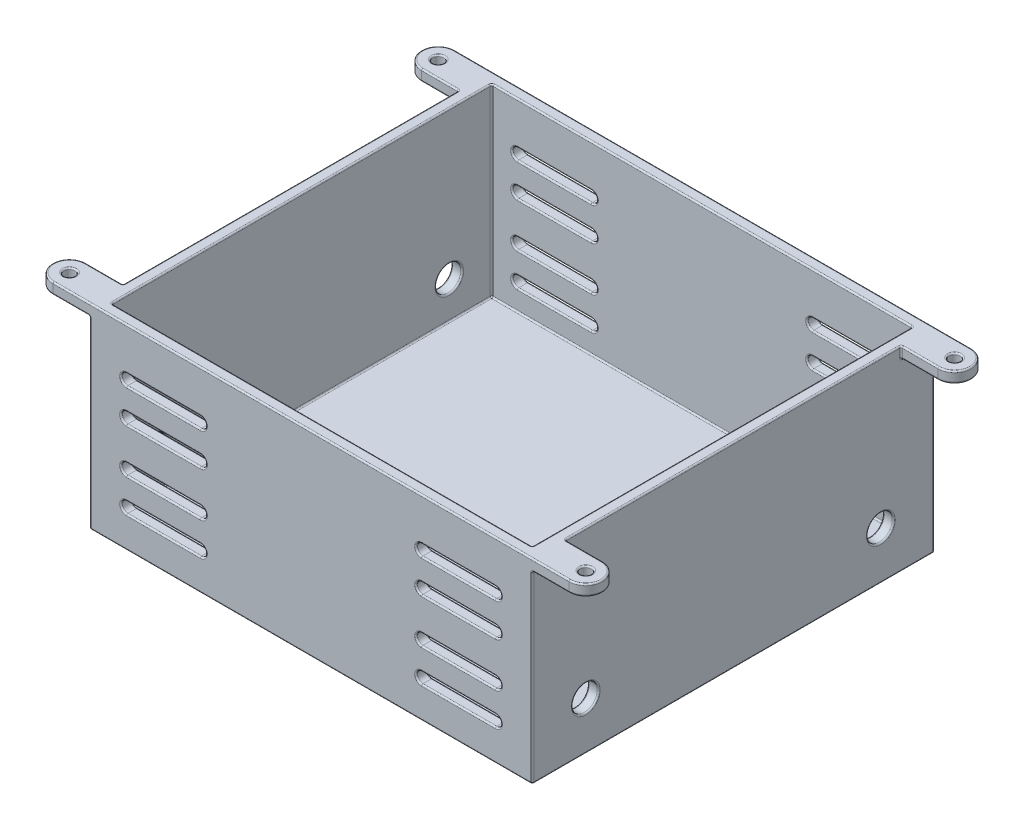
from build123d import *

# Parameters (mm, degrees)
SKETCH2_W               = 60
SKETCH2_H               = 54.5
SKETCH2_W_2             = 57
SKETCH2_H_2             = 51.5
BOSS_EXTRUDE1_DEPTH     = 25
SKETCH3_W               = 60
SKETCH3_H               = 54.5
BOSS_EXTRUDE2_DEPTH     = 1.5
SKETCH4_R               = 0.75
BOSS_EXTRUDE3_DEPTH     = 1.5
CUT_EXTRUDE1_DEPTH      = 54.220062007
CUT_EXTRUDE1_DEPTH_BACK = 54.220062007
CUT_EXTRUDE2_DEPTH      = 54.220062007
CUT_EXTRUDE2_DEPTH_BACK = 54.220062007
SKETCH6_R               = 1.75
FILLET1_R               = 0.2


with BuildPart() as part:
    # Sketch2 → Boss-Extrude1 (new body)
    with BuildSketch(Plane(origin=(0, 0, 0), x_dir=(1, 0, 0), z_dir=(0, 1, 0))):
        Rectangle(SKETCH2_W, SKETCH2_H)
        Rectangle(SKETCH2_W_2, SKETCH2_H_2, mode=Mode.SUBTRACT)
    extrude(amount=-BOSS_EXTRUDE1_DEPTH)

    # Sketch3 → Boss-Extrude2 (add)
    with BuildSketch(Plane.XZ.offset(25)):
        Rectangle(SKETCH3_W, SKETCH3_H)
    extrude(amount=BOSS_EXTRUDE2_DEPTH)

    # Sketch4 → Boss-Extrude3 (add)
    # profile 1 of 4: a face of its own
    with BuildSketch(Plane(origin=(0, 0, 0), x_dir=(1, 0, 0), z_dir=(0, 1, 0))):
        with BuildLine():
            Line((30, 22.75), (35, 22.75))
            ThreePointArc((35, 22.75), (37.25, 25), (35, 27.25))
            Line((35, 27.25), (30, 27.25))
            Line((30, 27.25), (30, 22.75))
        make_face()
        with Locations(Location((35, 25, 0), (0, 0, 270))):
            Circle(SKETCH4_R, mode=Mode.SUBTRACT)
    # profile 2 of 4: a face of its own
    with BuildSketch(Plane(origin=(0, 0, 0), x_dir=(1, 0, 0), z_dir=(0, 1, 0))):
        with BuildLine():
            Line((-30, 22.75), (-30, 27.25))
            Line((-30, 27.25), (-35, 27.25))
            ThreePointArc((-35, 27.25), (-37.25, 25), (-35, 22.75))
            Line((-35, 22.75), (-30, 22.75))
        make_face()
        with Locations(Location((-35, 25, 0), (0, 0, 270))):
            Circle(SKETCH4_R, mode=Mode.SUBTRACT)
    # profile 3 of 4: a face of its own
    with BuildSketch(Plane(origin=(0, 0, 0), x_dir=(1, 0, 0), z_dir=(0, 1, 0))):
        with BuildLine():
            ThreePointArc((35, -27.25), (37.25, -25), (35, -22.75))
            Line((35, -22.75), (30, -22.75))
            Line((30, -22.75), (30, -27.25))
            Line((30, -27.25), (35, -27.25))
        make_face()
        with Locations(Location((35, -25, 0), (0, 0, 270))):
            Circle(SKETCH4_R, mode=Mode.SUBTRACT)
    # profile 4 of 4: a face of its own
    with BuildSketch(Plane(origin=(0, 0, 0), x_dir=(1, 0, 0), z_dir=(0, 1, 0))):
        with BuildLine():
            Line((-30, -22.75), (-35, -22.75))
            ThreePointArc((-35, -22.75), (-37.25, -25), (-35, -27.25))
            Line((-35, -27.25), (-30, -27.25))
            Line((-30, -27.25), (-30, -22.75))
        make_face()
        with Locations(Location((-35, -25, 0), (0, 0, 270))):
            Circle(SKETCH4_R, mode=Mode.SUBTRACT)
    extrude(amount=-BOSS_EXTRUDE3_DEPTH)

    # Sketch5 → Cut-Extrude1 (cut, two sides: drawn at the far end of the back side and taken through both)
    with BuildSketch(Plane.XY.offset(-CUT_EXTRUDE1_DEPTH_BACK)):
        with BuildLine():
            Line((-25, -5.75), (-15, -5.75))
            ThreePointArc((-15, -5.75), (-14.25, -6.5), (-15, -7.25))
            Line((-15, -7.25), (-25, -7.25))
            ThreePointArc((-25, -7.25), (-25.75, -6.5), (-25, -5.75))
        make_face()
        with BuildLine():
            Line((-25, -10.25), (-15, -10.25))
            ThreePointArc((-15, -10.25), (-14.25, -11), (-15, -11.75))
            Line((-15, -11.75), (-25, -11.75))
            ThreePointArc((-25, -11.75), (-25.75, -11), (-25, -10.25))
        make_face()
        with BuildLine():
            Line((25, -10.25), (15, -10.25))
            ThreePointArc((15, -10.25), (14.25, -11), (15, -11.75))
            Line((15, -11.75), (25, -11.75))
            ThreePointArc((25, -11.75), (25.75, -11), (25, -10.25))
        make_face()
        with BuildLine():
            Line((25, -5.75), (15, -5.75))
            ThreePointArc((15, -5.75), (14.25, -6.5), (15, -7.25))
            Line((15, -7.25), (25, -7.25))
            ThreePointArc((25, -7.25), (25.75, -6.5), (25, -5.75))
        make_face()
        with BuildLine():
            Line((25, -22.25), (15, -22.25))
            ThreePointArc((15, -22.25), (14.25, -21.5), (15, -20.75))
            Line((15, -20.75), (25, -20.75))
            ThreePointArc((25, -20.75), (25.75, -21.5), (25, -22.25))
        make_face()
        with BuildLine():
            Line((25, -17.75), (15, -17.75))
            ThreePointArc((15, -17.75), (14.25, -17), (15, -16.25))
            Line((15, -16.25), (25, -16.25))
            ThreePointArc((25, -16.25), (25.75, -17), (25, -17.75))
        make_face()
        with BuildLine():
            Line((-25, -17.75), (-15, -17.75))
            ThreePointArc((-15, -17.75), (-14.25, -17), (-15, -16.25))
            Line((-15, -16.25), (-25, -16.25))
            ThreePointArc((-25, -16.25), (-25.75, -17), (-25, -17.75))
        make_face()
        with BuildLine():
            Line((-25, -22.25), (-15, -22.25))
            ThreePointArc((-15, -22.25), (-14.25, -21.5), (-15, -20.75))
            Line((-15, -20.75), (-25, -20.75))
            ThreePointArc((-25, -20.75), (-25.75, -21.5), (-25, -22.25))
        make_face()
    extrude(amount=CUT_EXTRUDE1_DEPTH + CUT_EXTRUDE1_DEPTH_BACK, mode=Mode.SUBTRACT)

    # Sketch6 → Cut-Extrude2 (cut, two sides: drawn at the far end of the back side and taken through both)
    with BuildSketch(Plane(origin=(0, 0, 0), x_dir=(0, 0, -1), z_dir=(1, 0, 0)).offset(-CUT_EXTRUDE2_DEPTH_BACK)):
        with Locations(Location((-20, -20, 0), (0, 0, 180))):
            Circle(SKETCH6_R)
        with Locations(Location((20, -20, 0), (0, 0, 180))):
            Circle(SKETCH6_R)
    extrude(amount=CUT_EXTRUDE2_DEPTH + CUT_EXTRUDE2_DEPTH_BACK, mode=Mode.SUBTRACT)

    # Fillet1
    fillet1_edges = [part.edges().sort_by_distance(p)[0] for p in [
        (-20, -7.25, 25.75),
        (-14.25, -6.5, 25.75),
        (-20, -5.75, 25.75),
        (-25.75, -6.5, 25.75),
        (-20, -22.25, 25.75),
        (-14.25, -21.5, 25.75),
        (-20, -20.75, 25.75),
        (-25.75, -21.5, 25.75),
        (-20, -17.75, 25.75),
        (-14.25, -17, 25.75),
        (-20, -16.25, 25.75),
        (-25.75, -17, 25.75),
        (20, -16.25, 25.75),
        (14.25, -17, 25.75),
        (20, -17.75, 25.75),
        (25.75, -17, 25.75),
        (-20, -11.75, 25.75),
        (-14.25, -11, 25.75),
        (-20, -10.25, 25.75),
        (-25.75, -11, 25.75),
        (20, -10.25, 25.75),
        (14.25, -11, 25.75),
        (20, -11.75, 25.75),
        (25.75, -11, 25.75),
        (20, -5.75, 25.75),
        (14.25, -6.5, 25.75),
        (20, -7.25, 25.75),
        (25.75, -6.5, 25.75),
        (20, -20.75, 25.75),
        (14.25, -21.5, 25.75),
        (20, -22.25, 25.75),
        (25.75, -21.5, 25.75),
        (0, -25, -25.75),
        (-28.5, -12.5, -25.75),
        (28.5, -25, 0),
        (28.5, -12.5, -25.75),
        (0, -25, 25.75),
        (28.5, -12.5, 25.75),
        (-28.5, -25, 0),
        (25.75, -21.5, -25.75),
        (25.75, -21.5, -27.25),
        (20, -22.25, -25.75),
        (20, -22.25, -27.25),
        (-28.5, -12.5, 25.75),
        (14.25, -21.5, -25.75),
        (14.25, -21.5, -27.25),
        (0, 0, -25.75),
        (20, -20.75, -25.75),
        (20, -20.75, -27.25),
        (25.75, -21.5, 27.25),
        (20, -20.75, 27.25),
        (14.25, -21.5, 27.25),
        (20, -22.25, 27.25),
        (-28.5, 0, 0),
        (0, 0, 25.75),
        (28.5, 0, 0),
        (25.75, -6.5, -25.75),
        (25.75, -6.5, -27.25),
        (20, -7.25, -25.75),
        (20, -7.25, -27.25),
        (14.25, -6.5, -25.75),
        (14.25, -6.5, -27.25),
        (20, -5.75, -25.75),
        (20, -5.75, -27.25),
        (25.75, -6.5, 27.25),
        (20, -5.75, 27.25),
        (14.25, -6.5, 27.25),
        (20, -7.25, 27.25),
        (25.75, -11, -25.75),
        (25.75, -11, -27.25),
        (20, -11.75, -25.75),
        (20, -11.75, -27.25),
        (14.25, -11, -25.75),
        (14.25, -11, -27.25),
        (20, -10.25, -25.75),
        (20, -10.25, -27.25),
        (25.75, -11, 27.25),
        (20, -10.25, 27.25),
        (14.25, -11, 27.25),
        (20, -11.75, 27.25),
        (-25.75, -11, -25.75),
        (-25.75, -11, -27.25),
        (-20, -10.25, -25.75),
        (-20, -10.25, -27.25),
        (-14.25, -11, -25.75),
        (-14.25, -11, -27.25),
        (-20, -11.75, -25.75),
        (-20, -11.75, -27.25),
        (-25.75, -11, 27.25),
        (-20, -11.75, 27.25),
        (-14.25, -11, 27.25),
        (-20, -10.25, 27.25),
        (25.75, -17, -25.75),
        (25.75, -17, -27.25),
        (20, -17.75, -25.75),
        (20, -17.75, -27.25),
        (14.25, -17, -25.75),
        (14.25, -17, -27.25),
        (20, -16.25, -25.75),
        (20, -16.25, -27.25),
        (25.75, -17, 27.25),
        (20, -16.25, 27.25),
        (14.25, -17, 27.25),
        (20, -17.75, 27.25),
        (-25.75, -17, -25.75),
        (-25.75, -17, -27.25),
        (-20, -16.25, -25.75),
        (-20, -16.25, -27.25),
        (-14.25, -17, -25.75),
        (-14.25, -17, -27.25),
        (-20, -17.75, -25.75),
        (-20, -17.75, -27.25),
        (-25.75, -17, 27.25),
        (-20, -17.75, 27.25),
        (-14.25, -17, 27.25),
        (-20, -16.25, 27.25),
        (-25.75, -21.5, -25.75),
        (-25.75, -21.5, -27.25),
        (-20, -20.75, -25.75),
        (-20, -20.75, -27.25),
        (-14.25, -21.5, -25.75),
        (-14.25, -21.5, -27.25),
        (-20, -22.25, -25.75),
        (-20, -22.25, -27.25),
        (-25.75, -21.5, 27.25),
        (-20, -22.25, 27.25),
        (-14.25, -21.5, 27.25),
        (-20, -20.75, 27.25),
        (-25.75, -6.5, -25.75),
        (-25.75, -6.5, -27.25),
        (-20, -5.75, -25.75),
        (-20, -5.75, -27.25),
        (-14.25, -6.5, -25.75),
        (-14.25, -6.5, -27.25),
        (-20, -7.25, -25.75),
        (-20, -7.25, -27.25),
        (-25.75, -6.5, 27.25),
        (-20, -7.25, 27.25),
        (-14.25, -6.5, 27.25),
        (-20, -5.75, 27.25),
        (0, -26.5, 27.25),
        (-30, -26.5, 0),
        (0, -26.5, -27.25),
        (30, -26.5, 0),
        (30, -20, 18.25),
        (-30, -20, 18.25),
        (28.5, -20, 18.25),
        (-28.5, -20, 18.25),
        (30, -20, -21.75),
        (-30, -20, -21.75),
        (28.5, -20, -21.75),
        (-28.5, -20, -21.75),
        (-30, 0, 0),
        (-37.25, -1.5, -25),
        (-32.5, -1.5, -22.75),
        (-30, -0.75, -22.75),
        (-35, 0, -25.75),
        (-32.5, -1.5, -27.25),
        (-30, -1.5, -25),
        (-35, -1.5, -25.75),
        (-37.25, 0, -25),
        (-32.5, 0, -22.75),
        (0, 0, -27.25),
        (0, 0, 27.25),
        (-32.5, 0, 22.75),
        (-30, -0.75, 22.75),
        (-35, 0, 24.25),
        (-37.25, -1.5, 25),
        (-35, -1.5, 24.25),
        (-32.5, -1.5, 22.75),
        (-30, -1.5, 25),
        (-32.5, -1.5, 27.25),
        (-37.25, 0, 25),
        (30, 0, 0),
        (32.5, -1.5, 22.75),
        (30, -0.75, 22.75),
        (35, 0, 24.25),
        (37.25, -1.5, 25),
        (35, -1.5, 24.25),
        (32.5, -1.5, 27.25),
        (30, -1.5, 25),
        (37.25, 0, 25),
        (32.5, 0, 22.75),
        (-30, -14, -27.25),
        (30, -14, -27.25),
        (30, -14, 27.25),
        (-30, -14, 27.25),
        (30, -0.75, -22.75),
        (37.25, -1.5, -25),
        (35, 0, -25.75),
        (32.5, 0, -22.75),
        (35, -1.5, -25.75),
        (30, -1.5, -25),
        (32.5, -1.5, -27.25),
        (32.5, -1.5, -22.75),
        (37.25, 0, -25),
    ]]
    fillet(fillet1_edges, radius=FILLET1_R)


solid = part.part
